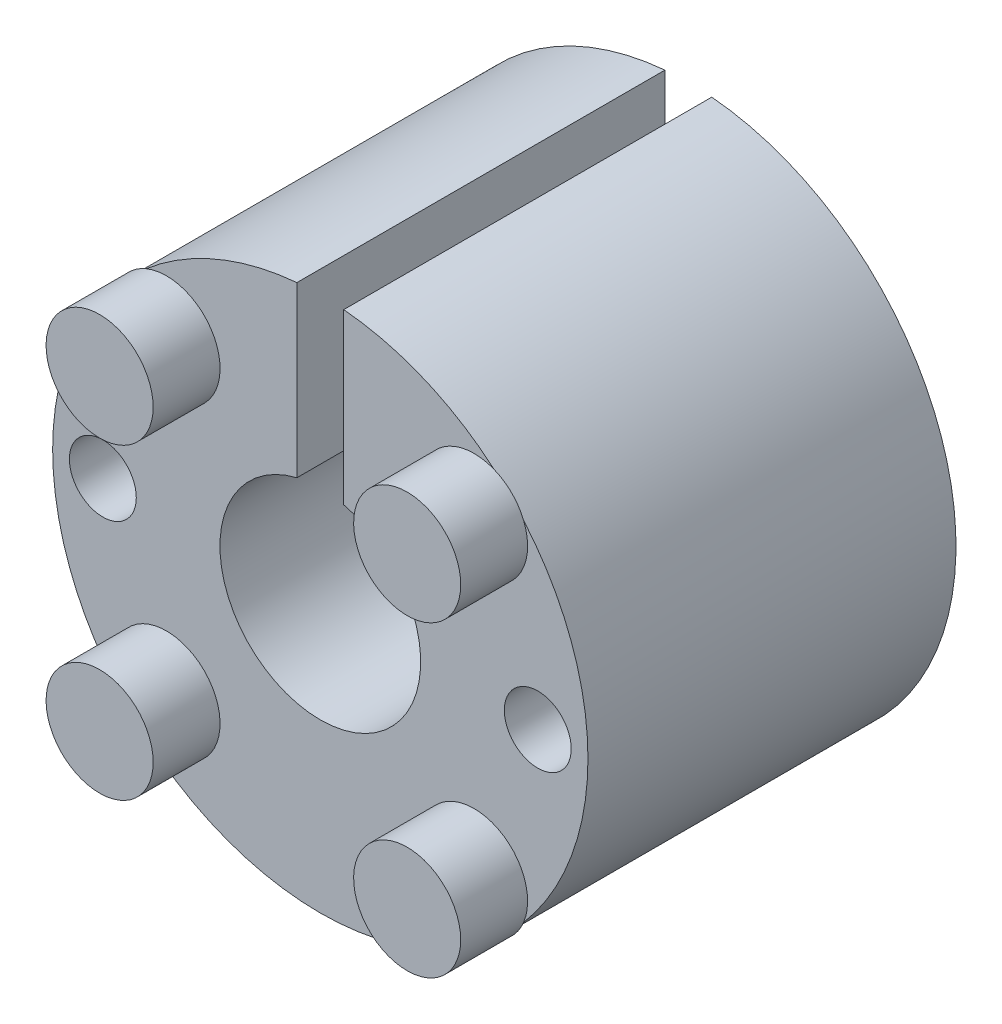
from build123d import *

# Parameters (mm, degrees)
SKETCH_1_R          = 8
SKETCH_1_R_2        = 3
EXTRUDE_1_DEPTH     = 11
SKETCH_2_W          = 1.4
SKETCH_2_H          = 7.329379883
CUT_EXTRUDE_1_DEPTH = 13.5
SKETCH_3_R          = 1
CUT_EXTRUDE_2_DEPTH = 3.5
SKETCH_4_R          = 1.6
EXTRUDE_3_DEPTH     = 2


with BuildPart() as part:
    # 草图1 → 凸台-拉伸1 (new body)
    with BuildSketch(Plane.XY):
        Circle(SKETCH_1_R)
        Circle(SKETCH_1_R_2, mode=Mode.SUBTRACT)
    extrude(amount=EXTRUDE_1_DEPTH)

    # 草图2 → 切除-拉伸1 (cut)
    with BuildSketch(Plane.XY.offset(11)):
        with Locations((0, 5.87801753)):
            Rectangle(SKETCH_2_W, SKETCH_2_H)
    extrude(amount=-CUT_EXTRUDE_1_DEPTH, mode=Mode.SUBTRACT)

    # 草图3 → 切除-拉伸2 (cut)
    with BuildSketch(Plane.XY.offset(11)):
        with Locations((6.5, 0)):
            Circle(SKETCH_3_R)
        with Locations((-6.5, 0)):
            Circle(SKETCH_3_R)
    extrude(amount=-CUT_EXTRUDE_2_DEPTH, mode=Mode.SUBTRACT)

    # 草图4 → 凸台-拉伸3 (add)
    with BuildSketch(Plane.XY.offset(11)):
        with Locations(Location((4.596194078, 4.596194078, 0), (0, 0, 67.691377582))):
            Circle(SKETCH_4_R)
        with Locations(Location((4.596194078, -4.596194078, 0), (0, 0, 292.308622418))):
            Circle(SKETCH_4_R)
        with Locations(Location((-4.596194078, -4.596194078, 0), (0, 0, 202.308622418))):
            Circle(SKETCH_4_R)
        with Locations(Location((-4.596194078, 4.596194078, 0), (0, 0, 157.691377582))):
            Circle(SKETCH_4_R)
    extrude(amount=EXTRUDE_3_DEPTH)


solid = part.part
